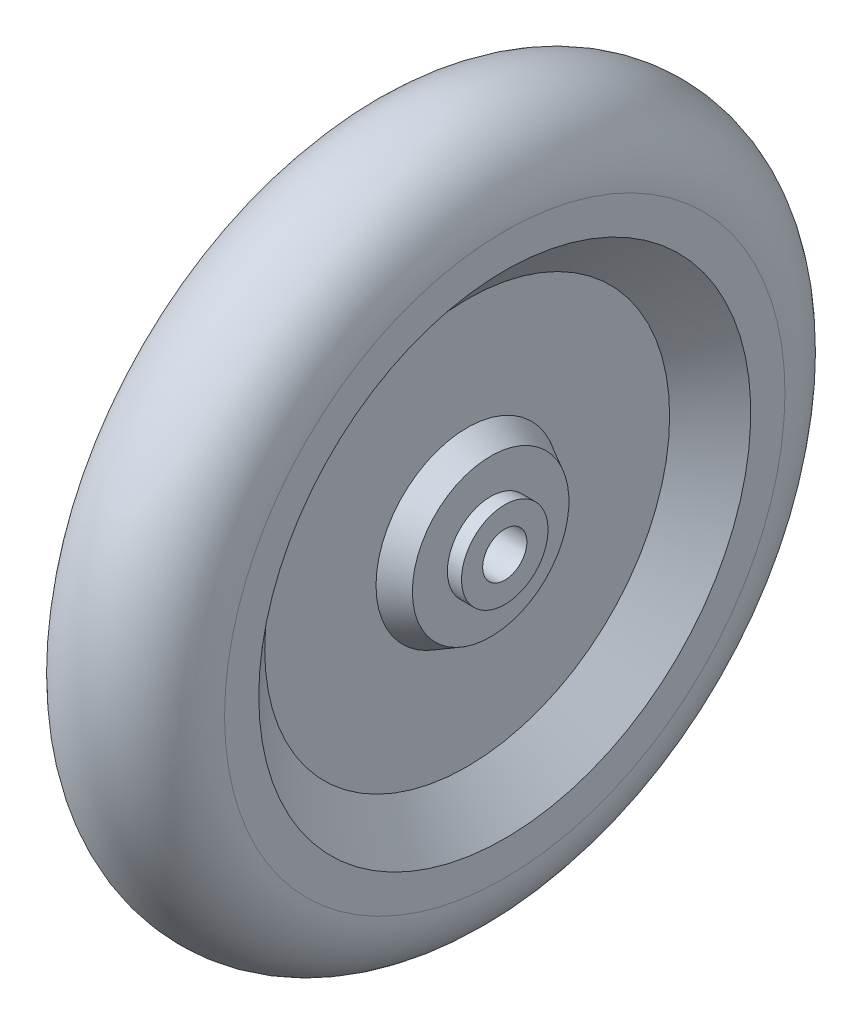
from build123d import *


with BuildPart() as part:
    # Sketch1 → Revolve1 (revolve)
    with BuildSketch(Plane.XY, mode=Mode.PRIVATE) as revolve1_sk:
        with BuildLine():
            Line((-15.875, 4.7625), (15.875, 4.7625))
            Line((15.875, 4.7625), (15.875, 9.311015131))
            Line((15.875, 9.311015131), (12.83850319, 9.311015131))
            Line((12.83850319, 9.311015131), (12.83850319, 16.850886509))
            Line((12.83850319, 16.850886509), (7.782087298, 19.62375974))
            Line((7.782087298, 19.62375974), (7.782087298, 43.587197627))
            Line((7.782087298, 43.587197627), (15.875, 52.96008786))
            Line((15.875, 52.96008786), (15.875, 60.325))
            ThreePointArc((15.875, 60.325), (0, 76.2), (-15.875, 60.325))
            Line((-15.875, 60.325), (-15.875, 52.96008786))
            Line((-15.875, 52.96008786), (-7.782087298, 43.587197627))
            Line((-7.782087298, 43.587197627), (-7.782087298, 19.62375974))
            Line((-7.782087298, 19.62375974), (-12.83850319, 16.850886509))
            Line((-12.83850319, 16.850886509), (-12.83850319, 9.311015131))
            Line((-12.83850319, 9.311015131), (-15.875, 9.311015131))
            Line((-15.875, 9.311015131), (-15.875, 4.7625))
        make_face()
    revolve(revolve1_sk.sketch.rotate(Axis((-1000, 0, 0), (1, 0, 0)), 90), axis=Axis((-1000, 0, 0), (1, 0, 0)))


solid = part.part
